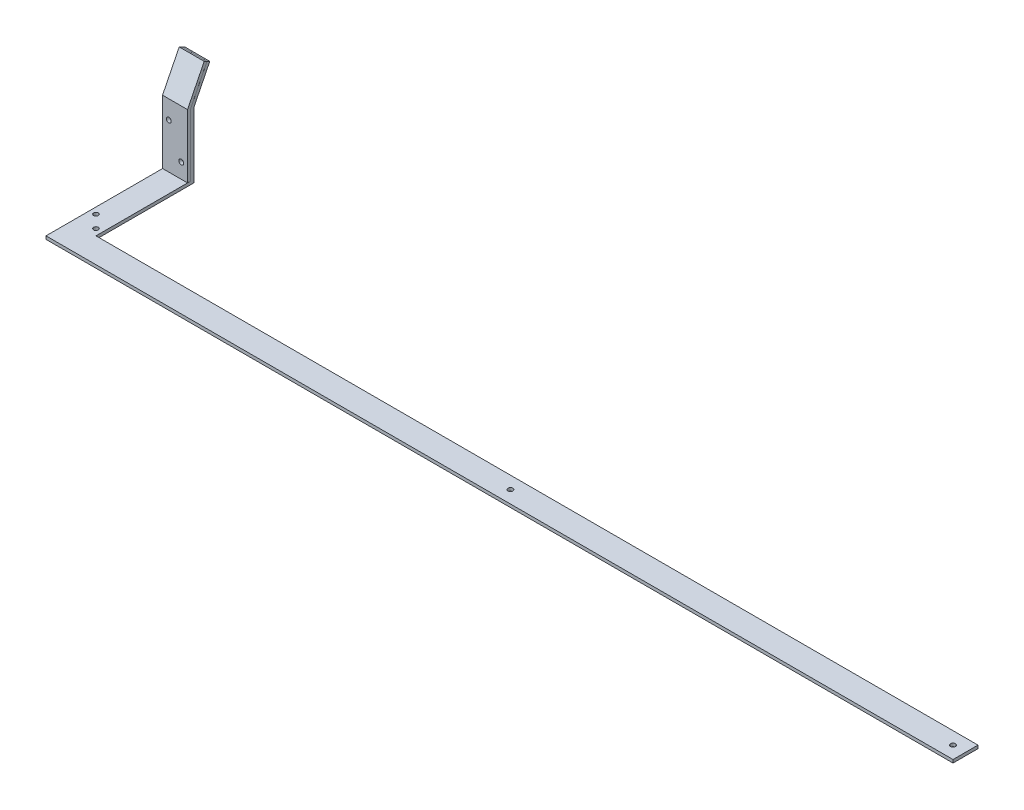
from build123d import *

# Parameters (mm, degrees)
SALIENTE_EXTRUIR1_DEPTH = 6.31
SALIENTE_EXTRUIR2_DEPTH = 50.8
SALIENTE_EXTRUIR3_DEPTH = 50.8
CROQUIS4_W              = 50.8
CROQUIS4_H              = 6.31
SALIENTE_EXTRUIR4_DEPTH = 50.8
CROQUIS5_R              = 4.7625
CORTAR_EXTRUIR1_DEPTH   = 50
CROQUIS6_R              = 5
CORTAR_EXTRUIR2_DEPTH   = 50
CROQUIS7_R              = 5
CORTAR_EXTRUIR3_DEPTH   = 50
CROQUIS8_R              = 5
CORTAR_EXTRUIR4_DEPTH   = 24


with BuildPart() as part:
    # Croquis1 → Saliente-Extruir1 (new body)
    with BuildSketch(Plane(origin=(0, 0, 0), x_dir=(1, 0, 0), z_dir=(0, 1, 0))):
        Polygon((1742.85, -198.902795), (1742.85, -249.702795), (-50.8, -249.702795), (-50.8, 0), (0, 0), (0, -198.902795), align=None)
    extrude(amount=SALIENTE_EXTRUIR1_DEPTH)

    # Croquis2 → Saliente-Extruir2 (add)
    with BuildSketch(Plane.ZY.offset(50.8)):
        Polygon((0, 6.31), (0, 132.55), (-32.572440357, 197.880208397), (-26.925404535, 200.695716598), (6.31, 134.035807771), (6.31, 6.31), align=None)
    extrude(amount=-SALIENTE_EXTRUIR2_DEPTH)

    # Croquis4 → Saliente-Extruir4 (add)
    with BuildSketch(Plane(origin=(1742.85, 0, 0), x_dir=(0, 0, -1), z_dir=(1, 0, 0))):
        with Locations((-224.302795, 3.155)):
            Rectangle(CROQUIS4_W, CROQUIS4_H)
    extrude(amount=SALIENTE_EXTRUIR4_DEPTH)

    # Croquis5 → Cortar-Extruir1 (cut)
    with BuildSketch(Plane(origin=(0, 0, 0), x_dir=(-1, 0, 0), z_dir=(0, -1, 0))):
        with Locations(Location((38.1, -160.802795, 0), (0, 0, 90))):
            Circle(CROQUIS5_R)
        with Locations(Location((12.7, -186.202795, 0), (0, 0, 90))):
            Circle(CROQUIS5_R)
    extrude(amount=-CORTAR_EXTRUIR1_DEPTH, mode=Mode.SUBTRACT)

    # Croquis6 → Cortar-Extruir2 (cut)
    with BuildSketch(Plane(origin=(0, 0, 0), x_dir=(-1, 0, 0), z_dir=(0, -1, 0))):
        with Locations(Location((-868.250000079, -224.302795, 0), (0, 0, 90))):
            Circle(CROQUIS6_R)
    extrude(amount=-CORTAR_EXTRUIR2_DEPTH, mode=Mode.SUBTRACT)

    # Croquis7 → Cortar-Extruir3 (cut)
    with BuildSketch(Plane(origin=(0, 0, 0), x_dir=(-1, 0, 0), z_dir=(0, -1, 0))):
        with Locations(Location((-1768.25, -224.302795, 0), (0, 0, 90))):
            Circle(CROQUIS7_R)
    extrude(amount=-CORTAR_EXTRUIR3_DEPTH, mode=Mode.SUBTRACT)


with BuildPart() as body_2:
    # Croquis3 → Saliente-Extruir3 (new body)
    with BuildSketch(Plane.ZY.offset(50.8)):
        Polygon((6.41, 6.41), (6.41, 134.059354646), (-26.835911099, 200.740336379), (-21.188875277, 203.55584458), (12.72, 135.545162417), (12.72, 6.41), align=None)
    extrude(amount=-SALIENTE_EXTRUIR3_DEPTH)


with BuildPart() as cortar_extruir4_tool:
    # Croquis8 → Cortar-Extruir4 (new body)
    with BuildSketch(Plane.XY.offset(12.72)):
        with Locations((-38.1, 98.1)):
            Circle(CROQUIS8_R)
        with Locations((-12.7, 36.91)):
            Circle(CROQUIS8_R)
    extrude(amount=-CORTAR_EXTRUIR4_DEPTH)


with BuildPart() as part_1:
    add(part.part)

    # Cortar-Extruir4: cut by cortar_extruir4_tool
    add(cortar_extruir4_tool.part, mode=Mode.SUBTRACT)


with BuildPart() as body_2_1:
    add(body_2.part)

    # Cortar-Extruir4: cut by cortar_extruir4_tool
    add(cortar_extruir4_tool.part, mode=Mode.SUBTRACT)


solid = Compound([part_1.part, body_2_1.part])
